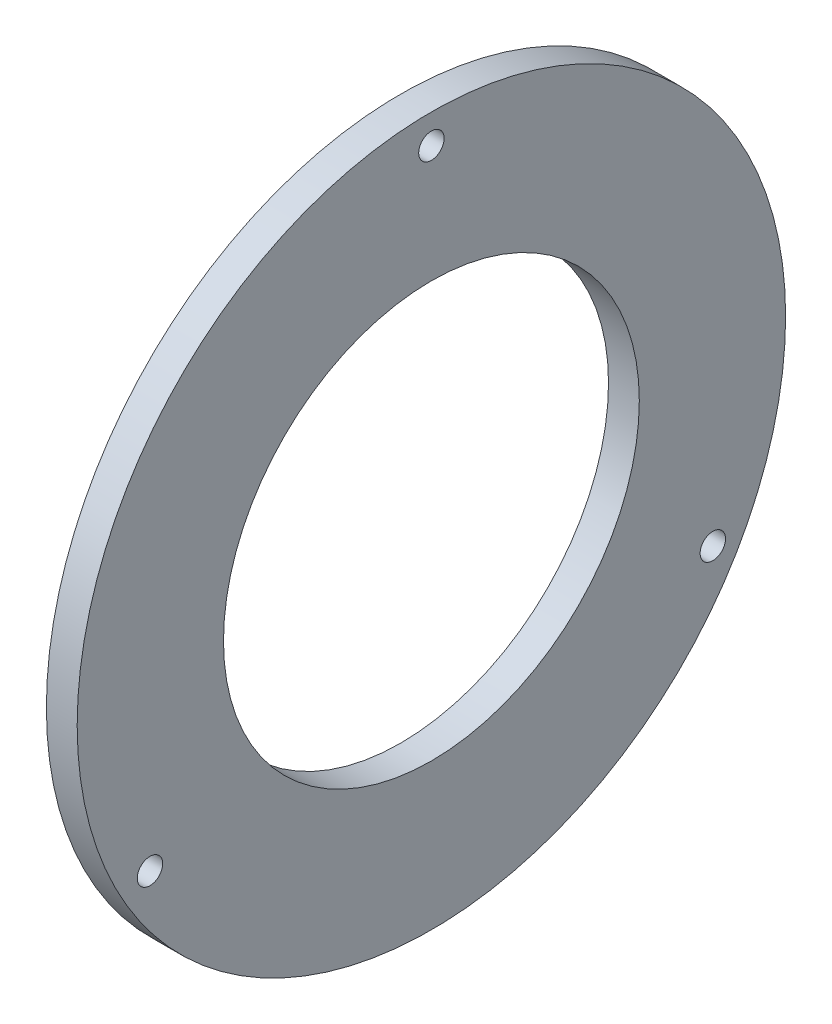
from build123d import *

# Parameters (mm, degrees)
AXIAL_PROFILE_MM_W     = 4
AXIAL_PROFILE_MM_H     = 19
AXIAL_HOLES_DEPTH      = 151.487507787
AXIAL_HOLES_DEPTH_BACK = 151.487507787
SKETCH2_R              = 1.65


with BuildPart() as part:
    # Axial profile (mm) → Full revolution (revolve)
    with BuildSketch(Plane.XY, mode=Mode.PRIVATE) as full_revolution_sk:
        with Locations((133.7, 36.5)):
            Rectangle(AXIAL_PROFILE_MM_W, AXIAL_PROFILE_MM_H)
    revolve(full_revolution_sk.sketch.rotate(Axis((-110, 0, 0), (1, 0, 0)), 90), axis=Axis((-110, 0, 0), (1, 0, 0)))

    # Sketch2 → Axial holes (cut, two sides: drawn at the far end of the back side and taken through both)
    with BuildSketch(Plane(origin=(0, 0, 0), x_dir=(0, 0, -1), z_dir=(1, 0, 0)).offset(-AXIAL_HOLES_DEPTH_BACK)):
        with Locations((0, 42.2)):
            Circle(SKETCH2_R)
        with Locations((-36.54627204, -21.1)):
            Circle(SKETCH2_R)
        with Locations((36.54627204, -21.1)):
            Circle(SKETCH2_R)
    extrude(amount=AXIAL_HOLES_DEPTH + AXIAL_HOLES_DEPTH_BACK, mode=Mode.SUBTRACT)


solid = part.part
